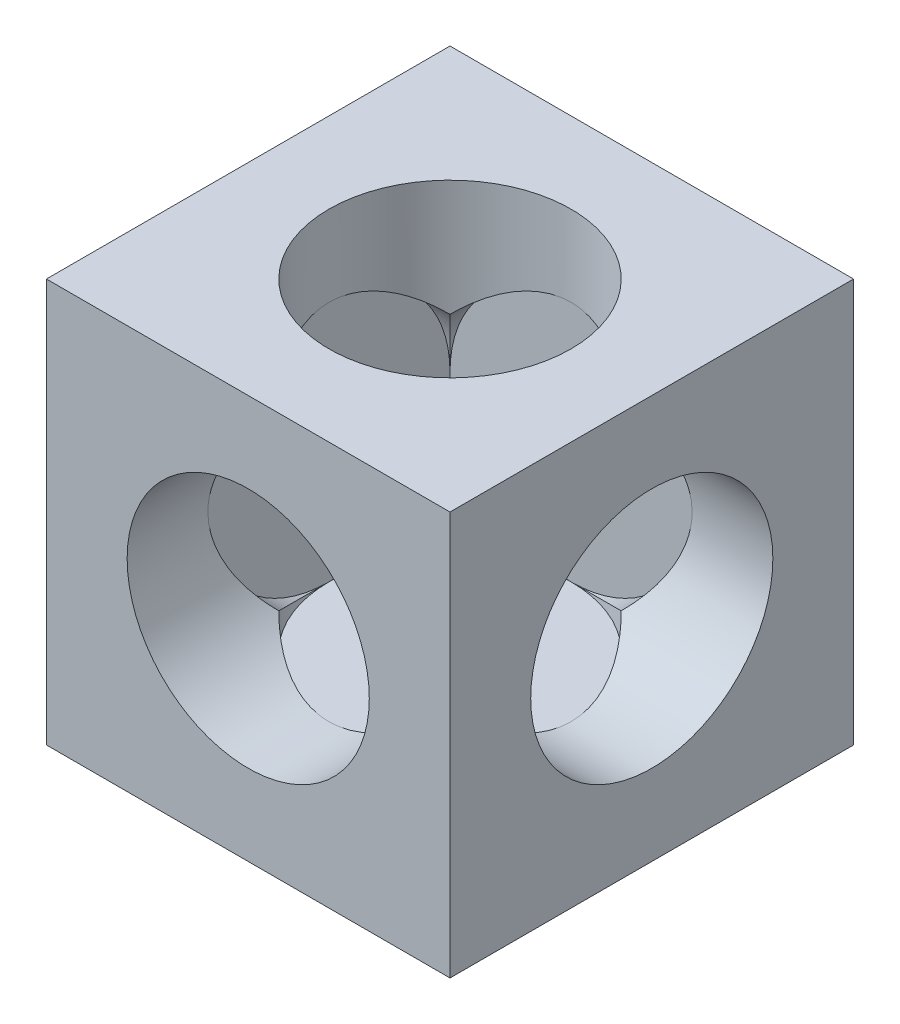
from build123d import *

# Parameters (mm, degrees)
SCHIZZO1_W                   = 10
SCHIZZO1_H                   = 10
ESTRUSIONE_ESTRUSIONE1_DEPTH = 10
FORO_FILETTATO_M3X0_5_1_D    = 2.5
FORO_FILETTATO_M3X0_5_2_D    = 2.5
FORO_FILETTATO_M3X0_5_3_D    = 2.5
SCHIZZO8_R                   = 3
TAGLIO_ESTRUSIONE1_DEPTH     = 8
SCHIZZO9_R                   = 3
TAGLIO_ESTRUSIONE2_DEPTH     = 8
SCHIZZO10_R                  = 3
TAGLIO_ESTRUSIONE3_DEPTH     = 8


with BuildPart() as part:
    # Schizzo1 → Estrusione-Estrusione1 (new body)
    with BuildSketch(Plane.XY):
        Rectangle(SCHIZZO1_W, SCHIZZO1_H)
    extrude(amount=ESTRUSIONE_ESTRUSIONE1_DEPTH)

    # Foro filettato M3x0.5-1 (through all)
    with Locations(Plane.XY.offset(10)):
        with Locations((0, 0)):
            Hole(FORO_FILETTATO_M3X0_5_1_D / 2)

    # Foro filettato M3x0.5-2 (through all)
    with Locations(Plane(origin=(5, 0, 0), x_dir=(0, 0, -1), z_dir=(1, 0, 0))):
        with Locations((-5, 0)):
            Hole(FORO_FILETTATO_M3X0_5_2_D / 2)

    # Foro filettato M3x0.5-3 (through all)
    with Locations(Plane(origin=(0, -5, 0), x_dir=(-1, 0, 0), z_dir=(0, -1, 0))):
        with Locations((0, -5)):
            Hole(FORO_FILETTATO_M3X0_5_3_D / 2)

    # Schizzo8 → Taglio-Estrusione1 (cut)
    with BuildSketch(Plane.XY.offset(10)):
        Circle(SCHIZZO8_R)
    extrude(amount=-TAGLIO_ESTRUSIONE1_DEPTH, mode=Mode.SUBTRACT)

    # Schizzo9 → Taglio-Estrusione2 (cut)
    with BuildSketch(Plane(origin=(5, 0, 0), x_dir=(0, 0, -1), z_dir=(1, 0, 0))):
        with Locations((-5, 0)):
            Circle(SCHIZZO9_R)
    extrude(amount=-TAGLIO_ESTRUSIONE2_DEPTH, mode=Mode.SUBTRACT)

    # Schizzo10 → Taglio-Estrusione3 (cut)
    with BuildSketch(Plane(origin=(0, 5, 0), x_dir=(1, 0, 0), z_dir=(0, 1, 0))):
        with Locations(Location((0, -5, 0), (0, 0, 180))):
            Circle(SCHIZZO10_R)
    extrude(amount=-TAGLIO_ESTRUSIONE3_DEPTH, mode=Mode.SUBTRACT)


solid = part.part
